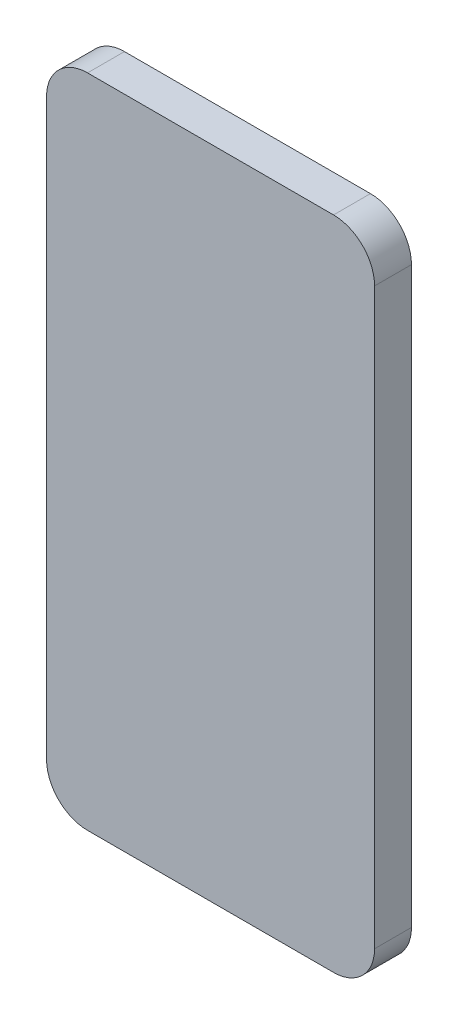
from build123d import *

# Parameters (mm, degrees)
SKETCH_1_W      = 80
SKETCH_1_H      = 160
EXTRUDE_1_DEPTH = 9
FILLET_1_R      = 10
FILLET_2_R      = 10
FILLET_3_R      = 10
FILLET_4_R      = 10


with BuildPart() as part:
    # 草图1 → 凸台-拉伸1 (new body)
    with BuildSketch(Plane.XY):
        with Locations((0.826446281, -39.338842975)):
            Rectangle(SKETCH_1_W, SKETCH_1_H)
    extrude(amount=EXTRUDE_1_DEPTH)

    # 圆角1
    fillet_1_edges = [part.edges().sort_by_distance(p)[0] for p in [
        (-39.173553719, 40.661157025, 4.5),
    ]]
    fillet(fillet_1_edges, radius=FILLET_1_R)

    # 圆角2
    fillet_2_edges = [part.edges().sort_by_distance(p)[0] for p in [
        (40.826446281, 40.661157025, 4.5),
    ]]
    fillet(fillet_2_edges, radius=FILLET_2_R)

    # 圆角3
    fillet_3_edges = [part.edges().sort_by_distance(p)[0] for p in [
        (40.826446281, -119.338842975, 4.5),
    ]]
    fillet(fillet_3_edges, radius=FILLET_3_R)

    # 圆角4
    fillet_4_edges = [part.edges().sort_by_distance(p)[0] for p in [
        (-39.173553719, -119.338842975, 4.5),
    ]]
    fillet(fillet_4_edges, radius=FILLET_4_R)


solid = part.part
